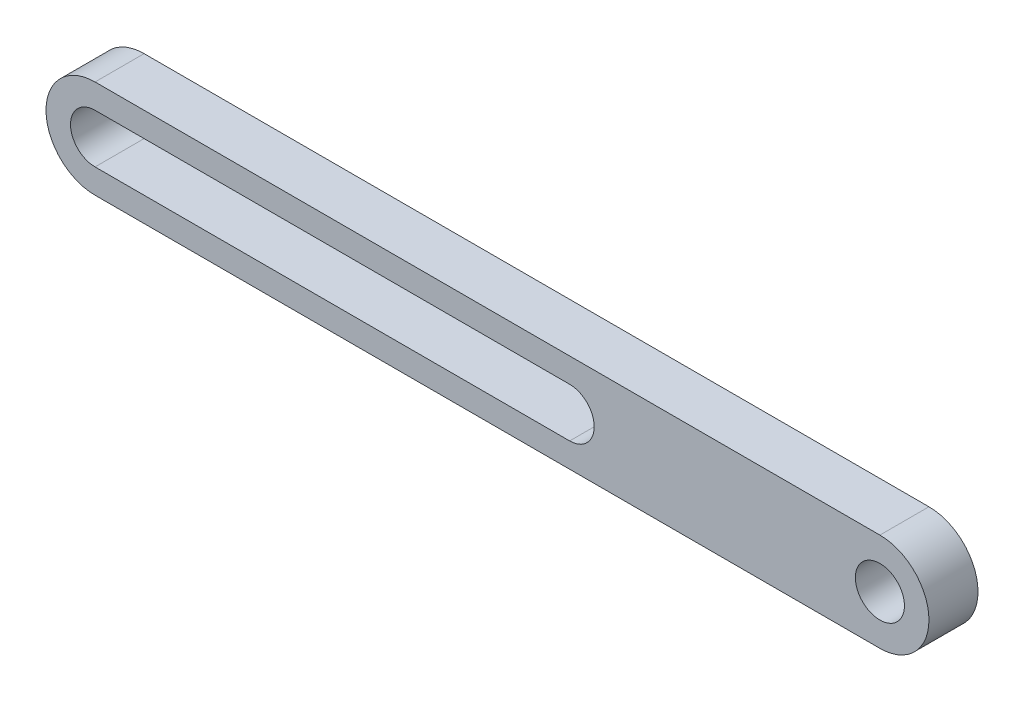
from build123d import *

# Parameters (mm, degrees)
EXTRUDE_2_DEPTH     = 5
SKETCH_3_R          = 2.5
CUT_EXTRUDE_2_DEPTH = 15


with BuildPart() as part:
    # 草图2 → 凸台-拉伸2 (new body)
    with BuildSketch(Plane.XY):
        with BuildLine():
            Line((0, 0), (79.999999139, 0))
            ThreePointArc((79.999999139, 0), (85, -4.999999569), (80, -10))
            Line((80, -10), (0, -10))
            ThreePointArc((0, -10), (-5, -5), (0, 0))
        make_face()
    extrude(amount=EXTRUDE_2_DEPTH)

    # 草图3 → 切除-拉伸2 (cut)
    with BuildSketch(Plane.XY.offset(5)):
        with Locations((80, -5)):
            Circle(SKETCH_3_R)
        with BuildLine():
            Line((0, -2.5), (48.378214102, -2.5))
            ThreePointArc((48.378214102, -2.5), (50.878214102, -5), (48.378214102, -7.5))
            Line((48.378214102, -7.5), (0, -7.5))
            ThreePointArc((0, -7.5), (-2.5, -5), (0, -2.5))
        make_face()
    extrude(amount=-CUT_EXTRUDE_2_DEPTH, mode=Mode.SUBTRACT)


solid = part.part
